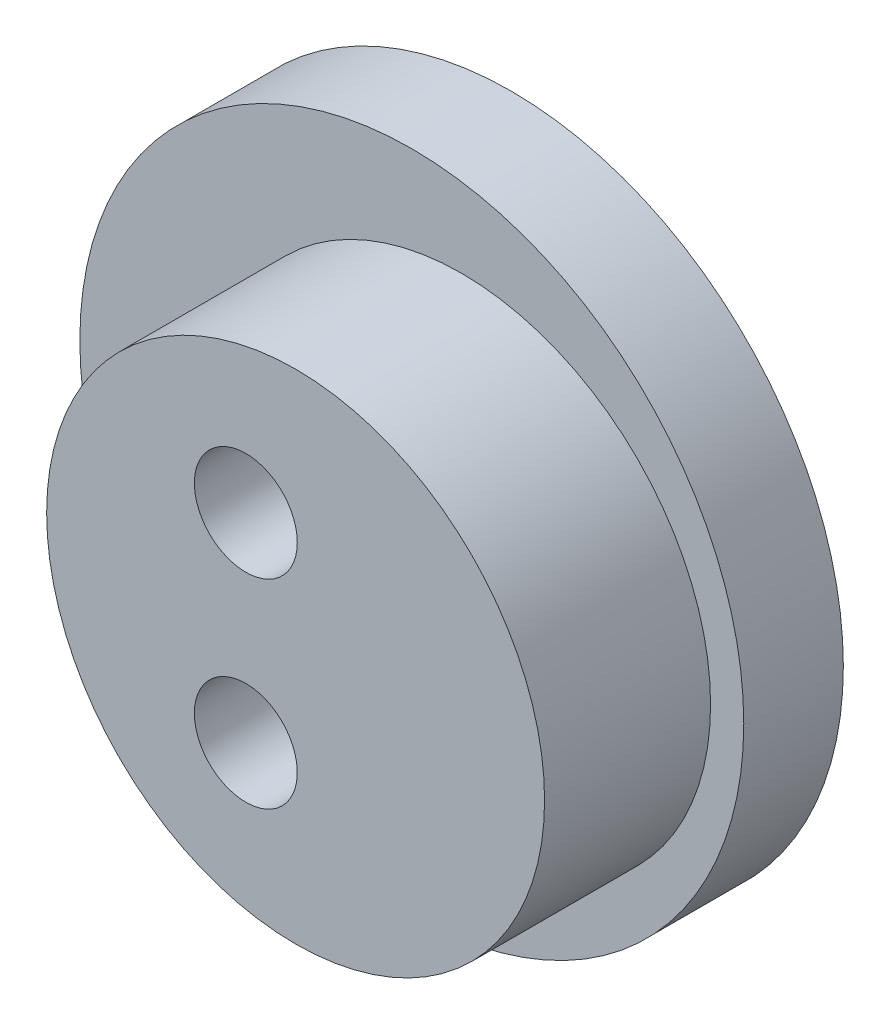
from build123d import *

# Parameters (mm, degrees)
SKETCH1_R           = 10
BOSS_EXTRUDE1_DEPTH = 3
SKETCH2_R           = 7.5
BOSS_EXTRUDE2_DEPTH = 5
SKETCH3_R           = 1.55
CUT_EXTRUDE1_DEPTH  = 17.248076809


with BuildPart() as part:
    # Sketch1 → Boss-Extrude1 (new body)
    with BuildSketch(Plane.XY):
        Circle(SKETCH1_R)
    extrude(amount=BOSS_EXTRUDE1_DEPTH)

    # Sketch2 → Boss-Extrude2 (add)
    with BuildSketch(Plane.XY.offset(3)):
        with Locations((1.5, 0)):
            Circle(SKETCH2_R)
    extrude(amount=BOSS_EXTRUDE2_DEPTH)

    # Sketch3 → Cut-Extrude1 (cut, through all)
    with BuildSketch(Plane.XY.offset(8)):
        with Locations((0, 3)):
            Circle(SKETCH3_R)
        with Locations(Location((0, -3, 0), (0, 0, 180))):
            Circle(SKETCH3_R)
    extrude(amount=-CUT_EXTRUDE1_DEPTH, mode=Mode.SUBTRACT)


solid = part.part
